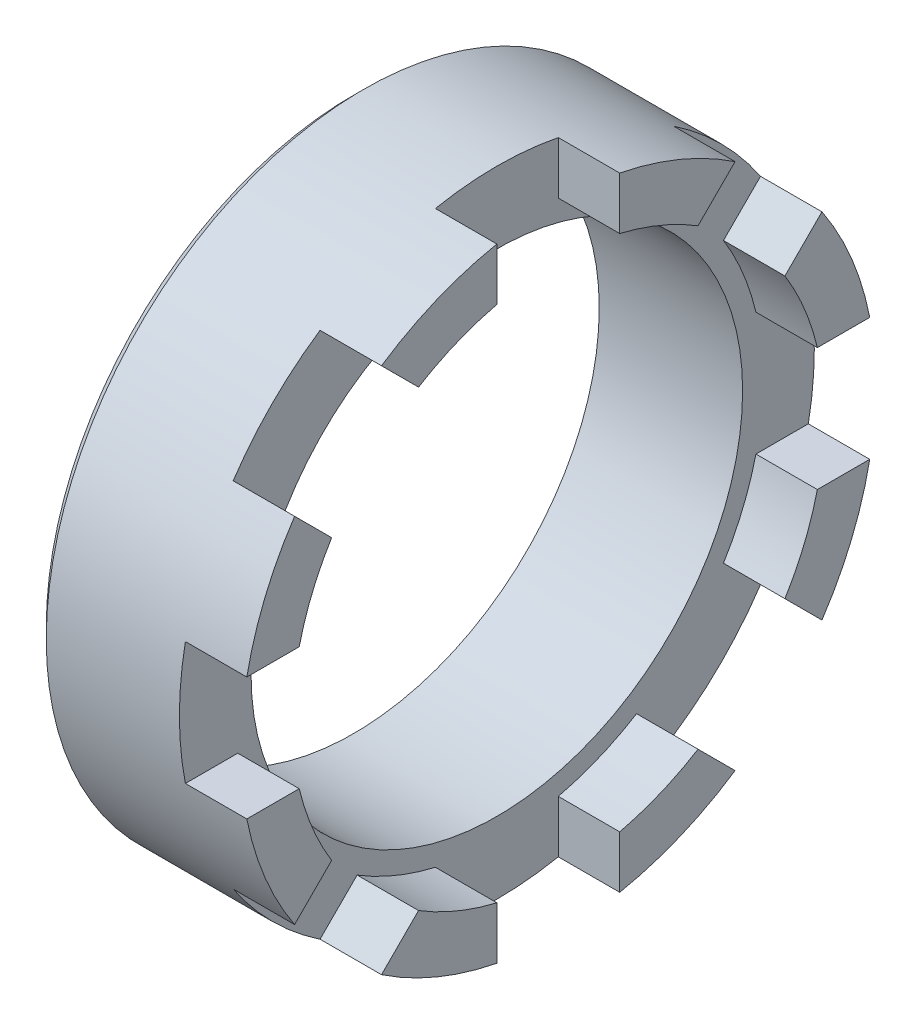
from build123d import *

# Parameters (mm, degrees)
ESQUISSE2_W                  = 4
ESQUISSE2_H                  = 6
ENL_V_MAT_EXTRU_1_DEPTH      = 37.503424497
R_P_TITION_CIRCULAIRE1_COUNT = 4
R_P_TITION_CIRCULAIRE1_ANGLE = 135


with BuildPart() as part:
    # Esquisse1 → Base-Révolution (revolve)
    with BuildSketch(Plane.XY, mode=Mode.PRIVATE) as base_r_volution_sk:
        Polygon((0, 12), (0, 15), (0.5, 15.5), (10, 15.5), (10, 13), (7, 13), (7, 12), align=None)
    revolve(base_r_volution_sk.sketch.rotate(Axis((-2, 0, 0), (1, 0, 0)), 90), axis=Axis((-2, 0, 0), (1, 0, 0)))

    # Esquisse2 → Enlèv. mat.-Extru.1 (cut, through all)
    with BuildSketch(Plane(origin=(0, 16, 0), x_dir=(-1, 0, 0), z_dir=(0, 1, 0))):
        with Locations((-9, 0)):
            Rectangle(ESQUISSE2_W, ESQUISSE2_H)
    enl_v_mat_extru_1 = extrude(amount=-ENL_V_MAT_EXTRU_1_DEPTH, mode=Mode.SUBTRACT)

    # Répétition circulaire1: Enlèv. mat.-Extru.1 ×4 about axis
    r_p_tition_circulaire1_axis = Axis((-2, 0, 0), (1, 0, 0))
    for i in range(1, R_P_TITION_CIRCULAIRE1_COUNT):
        add(enl_v_mat_extru_1.rotate(r_p_tition_circulaire1_axis, i * R_P_TITION_CIRCULAIRE1_ANGLE / (R_P_TITION_CIRCULAIRE1_COUNT - 1)), mode=Mode.SUBTRACT)


solid = part.part
